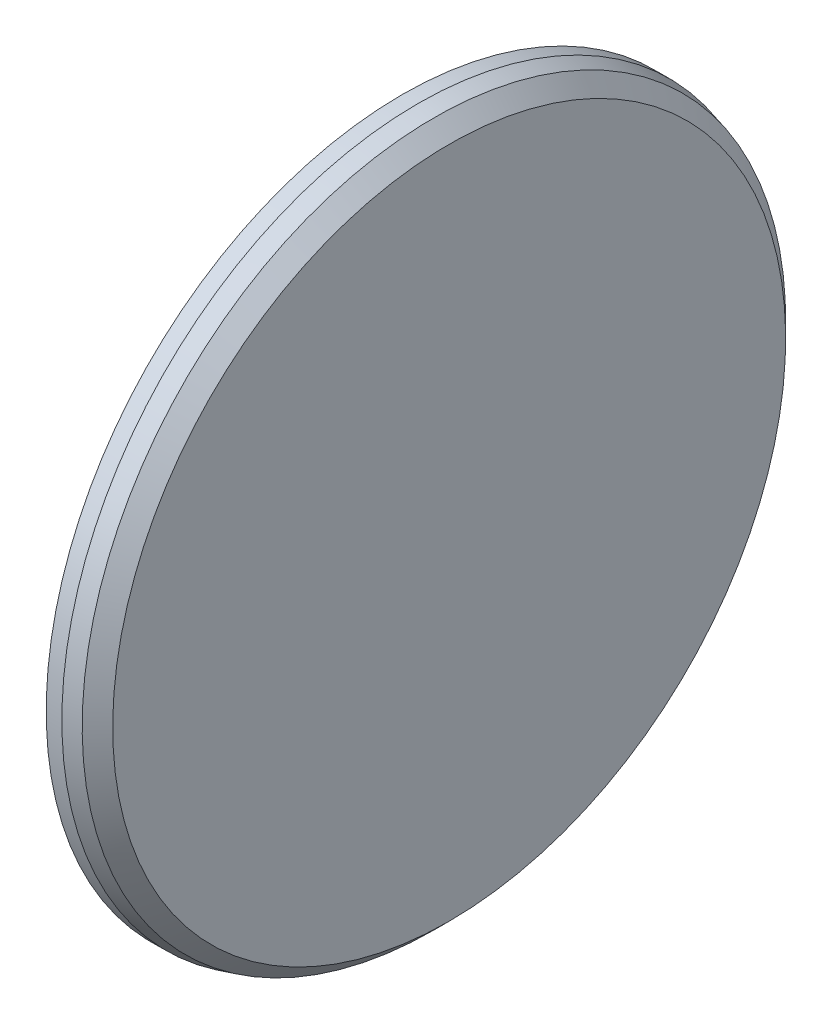
from build123d import *


with BuildPart() as part:
    # Sketch1 → Revolve1 (revolve)
    with BuildSketch(Plane.XY, mode=Mode.PRIVATE) as revolve1_sk:
        Polygon((-40, 100), (-40, 0), (40, 0), (40, 430), (20.490381057, 449.509618943), (0, 455), (-20, 455), (-20, 410), (10, 410), (10, 100), (-20, 100), align=None)
    revolve(revolve1_sk.sketch.rotate(Axis((-40, 0, 0), (1, 0, 0)), 180), axis=Axis((-40, 0, 0), (1, 0, 0)))


solid = part.part
